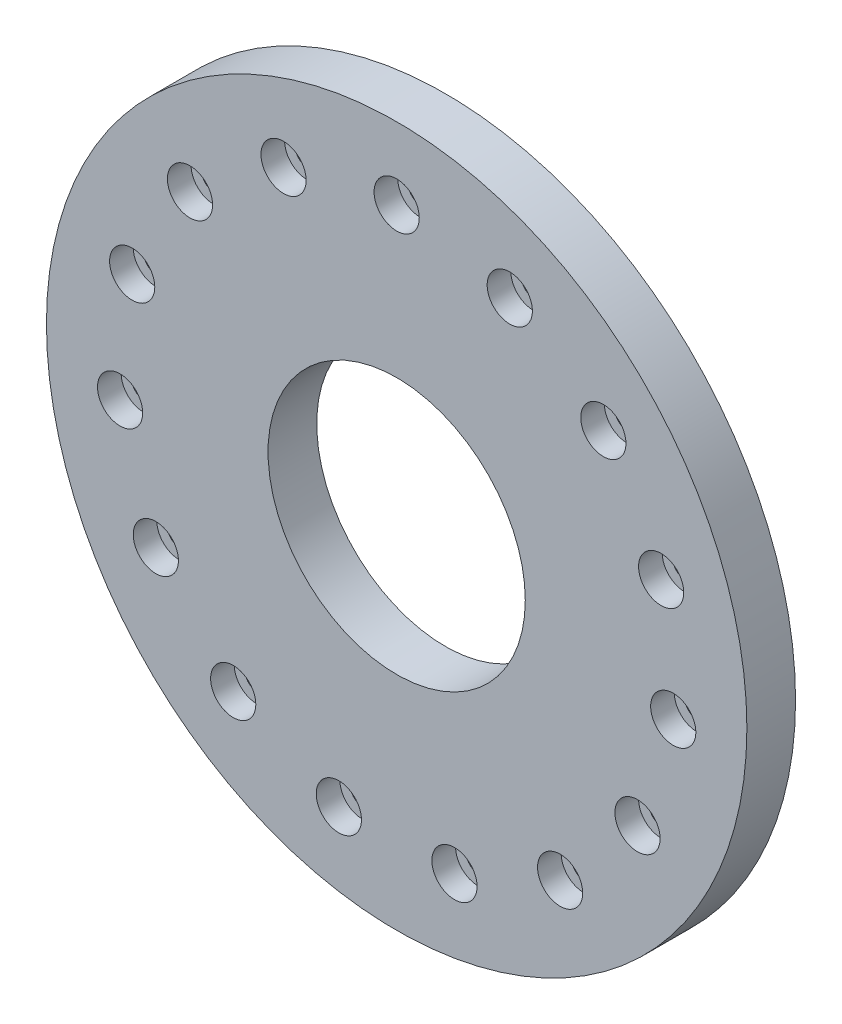
from build123d import *

# Parameters (mm, degrees)
SKETCH1_R                                           = 50.375
BOSS_EXTRUDE1_DEPTH                                 = 7
SKETCH3_R                                           = 18.5
CUT_EXTRUDE2_DEPTH                                  = 72.584085173
CBORE_FOR_M3_HEX_SOCKET_HEAD_CAP_SCREW1_D           = 3.4
CBORE_FOR_M3_HEX_SOCKET_HEAD_CAP_SCREW1_CBORE_D     = 6.5
CBORE_FOR_M3_HEX_SOCKET_HEAD_CAP_SCREW1_CBORE_DEPTH = 3.4
CIRPATTERN1_COUNT                                   = 15


with BuildPart() as part:
    # Sketch1 → Boss-Extrude1 (new body)
    with BuildSketch(Plane.XY):
        Circle(SKETCH1_R)
    extrude(amount=BOSS_EXTRUDE1_DEPTH)

    # Sketch3 → Cut-Extrude2 (cut, through all)
    with BuildSketch(Plane.XY.offset(7)):
        Circle(SKETCH3_R)
    extrude(amount=-CUT_EXTRUDE2_DEPTH, mode=Mode.SUBTRACT)

    # CBORE for M3 Hex Socket Head Cap Screw1 (through all)
    with Locations(Plane.XY.offset(7)):
        with Locations((0, 40)):
            cbore_for_m3_hex_socket_head_cap_screw1 = CounterBoreHole(CBORE_FOR_M3_HEX_SOCKET_HEAD_CAP_SCREW1_D / 2, CBORE_FOR_M3_HEX_SOCKET_HEAD_CAP_SCREW1_CBORE_D / 2, CBORE_FOR_M3_HEX_SOCKET_HEAD_CAP_SCREW1_CBORE_DEPTH)

    # CirPattern1: CBORE for M3 Hex Socket Head Cap Screw1 ×15 about axis
    cirpattern1_axis = Axis((0, 0, 0), (0, 0, 1))
    for i in range(1, CIRPATTERN1_COUNT):
        add(cbore_for_m3_hex_socket_head_cap_screw1.rotate(cirpattern1_axis, i * 360 / CIRPATTERN1_COUNT), mode=Mode.SUBTRACT)


solid = part.part
